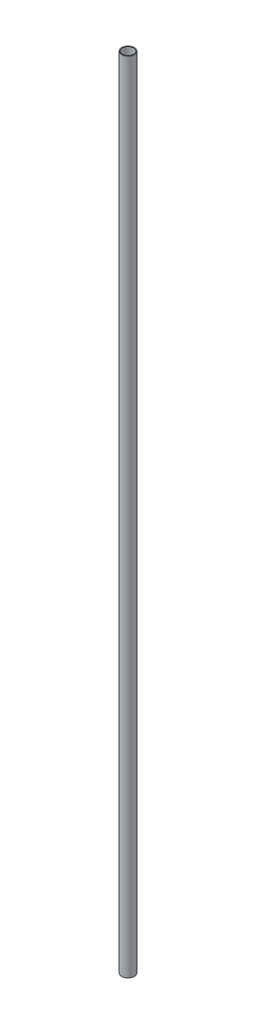
from build123d import *

# Parameters (mm, degrees)
SCHIZZO1_R                   = 9
SCHIZZO1_R_2                 = 8
ESTRUSIONE_ESTRUSIONE1_DEPTH = 1150


with BuildPart() as part:
    # Schizzo1 → Estrusione-Estrusione1 (new body)
    with BuildSketch(Plane(origin=(0, 0, 0), x_dir=(1, 0, 0), z_dir=(0, 1, 0))):
        with Locations(Location((0, 0, 0), (0, 0, 270))):
            Circle(SCHIZZO1_R)
        with Locations(Location((0, 0, 0), (0, 0, 270))):
            Circle(SCHIZZO1_R_2, mode=Mode.SUBTRACT)
    extrude(amount=ESTRUSIONE_ESTRUSIONE1_DEPTH)


solid = part.part
